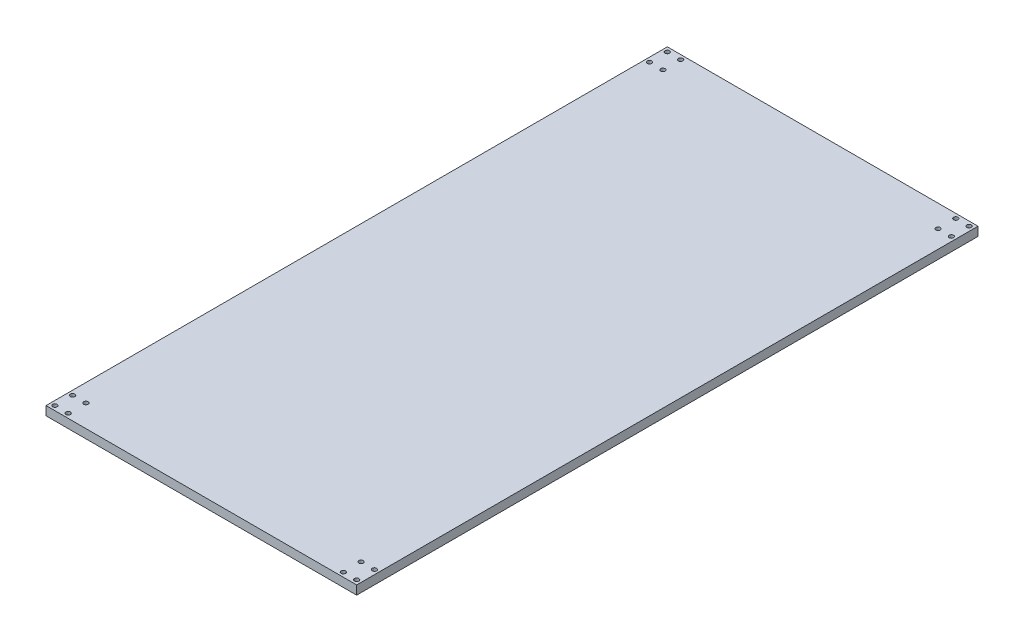
from build123d import *

# Parameters (mm, degrees)
SKETCH_1_W      = 350
SKETCH_1_H      = 700
SKETCH_1_R      = 2.5
EXTRUDE_1_DEPTH = 10


with BuildPart() as part:
    # Эскиз1 → Бобышка-Вытянуть1 (new body)
    with BuildSketch(Plane(origin=(0, 0, 0), x_dir=(1, 0, 0), z_dir=(0, 1, 0))):
        Rectangle(SKETCH_1_W, SKETCH_1_H)
        with Locations(Location((170, 345, 0), (0, 0, 270))):
            Circle(SKETCH_1_R, mode=Mode.SUBTRACT)
        with Locations(Location((155, 345, 0), (0, 0, 270))):
            Circle(SKETCH_1_R, mode=Mode.SUBTRACT)
        with Locations(Location((155, 325, 0), (0, 0, 270))):
            Circle(SKETCH_1_R, mode=Mode.SUBTRACT)
        with Locations(Location((170, 325, 0), (0, 0, 270))):
            Circle(SKETCH_1_R, mode=Mode.SUBTRACT)
        with Locations(Location((-170, 325, 0), (0, 0, 90))):
            Circle(SKETCH_1_R, mode=Mode.SUBTRACT)
        with Locations(Location((-155, 325, 0), (0, 0, 90))):
            Circle(SKETCH_1_R, mode=Mode.SUBTRACT)
        with Locations(Location((-155, 345, 0), (0, 0, 90))):
            Circle(SKETCH_1_R, mode=Mode.SUBTRACT)
        with Locations(Location((-170, 345, 0), (0, 0, 90))):
            Circle(SKETCH_1_R, mode=Mode.SUBTRACT)
        with Locations(Location((-170, -345, 0), (0, 0, 270))):
            Circle(SKETCH_1_R, mode=Mode.SUBTRACT)
        with Locations(Location((-155, -345, 0), (0, 0, 270))):
            Circle(SKETCH_1_R, mode=Mode.SUBTRACT)
        with Locations(Location((-155, -325, 0), (0, 0, 270))):
            Circle(SKETCH_1_R, mode=Mode.SUBTRACT)
        with Locations(Location((-170, -325, 0), (0, 0, 270))):
            Circle(SKETCH_1_R, mode=Mode.SUBTRACT)
        with Locations(Location((170, -325, 0), (0, 0, 90))):
            Circle(SKETCH_1_R, mode=Mode.SUBTRACT)
        with Locations(Location((155, -325, 0), (0, 0, 90))):
            Circle(SKETCH_1_R, mode=Mode.SUBTRACT)
        with Locations(Location((155, -345, 0), (0, 0, 90))):
            Circle(SKETCH_1_R, mode=Mode.SUBTRACT)
        with Locations(Location((170, -345, 0), (0, 0, 90))):
            Circle(SKETCH_1_R, mode=Mode.SUBTRACT)
    extrude(amount=EXTRUDE_1_DEPTH)


solid = part.part
